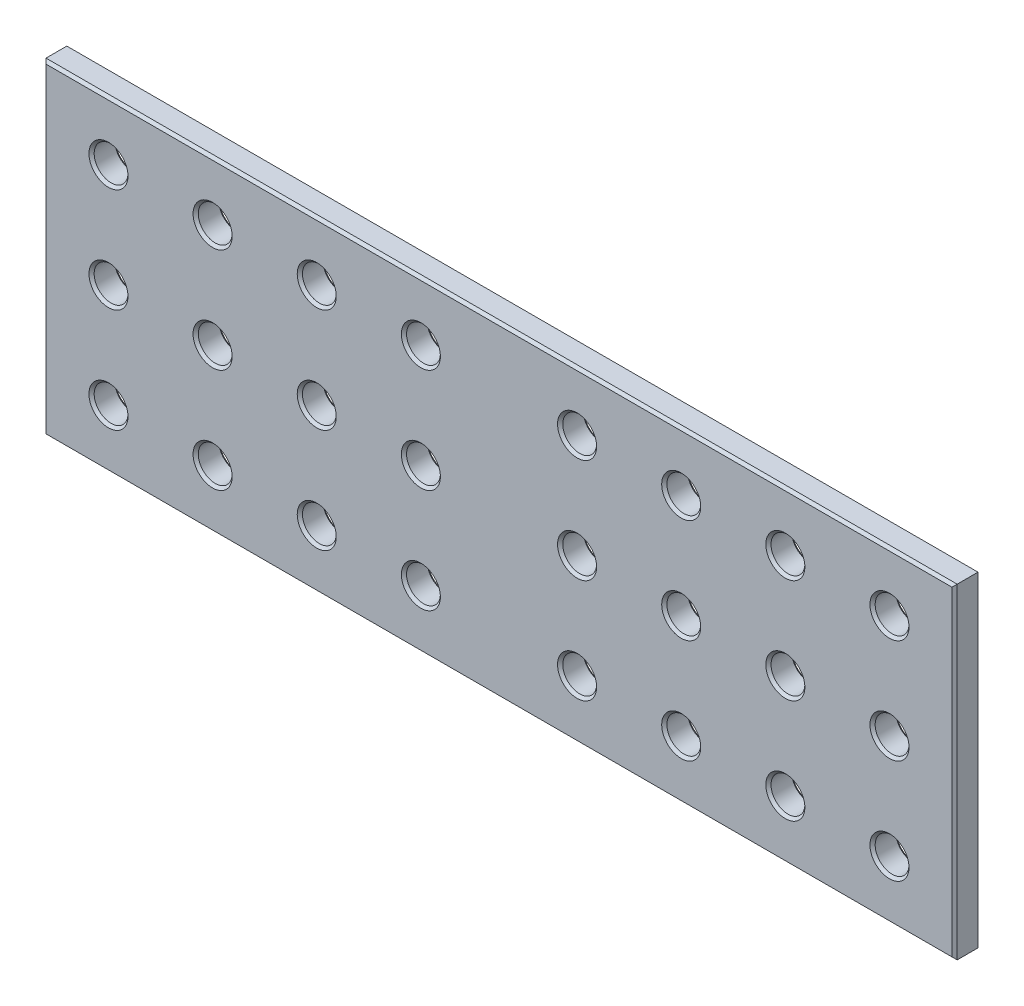
from build123d import *

# Parameters (mm, degrees)
SKETCH_1_W        = 700
SKETCH_1_H        = 250
SKETCH_1_R        = 13
EXTRUDE_664_DEPTH = 20
CHAMFER_1_SIZE    = 2


with BuildPart() as part:
    # 草图1 → Extrude 664 (new body)
    with BuildSketch(Plane.XY):
        Rectangle(SKETCH_1_W, SKETCH_1_H)
        with Locations((-300, 80)):
            Circle(SKETCH_1_R, mode=Mode.SUBTRACT)
        with Locations((-220, 80)):
            Circle(SKETCH_1_R, mode=Mode.SUBTRACT)
        with Locations((-140, 80)):
            Circle(SKETCH_1_R, mode=Mode.SUBTRACT)
        with Locations((-60, 80)):
            Circle(SKETCH_1_R, mode=Mode.SUBTRACT)
        with Locations((-60, 0)):
            Circle(SKETCH_1_R, mode=Mode.SUBTRACT)
        with Locations((-220, 0)):
            Circle(SKETCH_1_R, mode=Mode.SUBTRACT)
        with Locations((-300, 0)):
            Circle(SKETCH_1_R, mode=Mode.SUBTRACT)
        with Locations((-140, 0)):
            Circle(SKETCH_1_R, mode=Mode.SUBTRACT)
        with Locations(Location((-60, -80, 0), (0, 0, 180))):
            Circle(SKETCH_1_R, mode=Mode.SUBTRACT)
        with Locations(Location((-140, -80, 0), (0, 0, 180))):
            Circle(SKETCH_1_R, mode=Mode.SUBTRACT)
        with Locations(Location((-220, -80, 0), (0, 0, 180))):
            Circle(SKETCH_1_R, mode=Mode.SUBTRACT)
        with Locations(Location((-300, -80, 0), (0, 0, 180))):
            Circle(SKETCH_1_R, mode=Mode.SUBTRACT)
        with Locations((300, -80)):
            Circle(SKETCH_1_R, mode=Mode.SUBTRACT)
        with Locations((220, -80)):
            Circle(SKETCH_1_R, mode=Mode.SUBTRACT)
        with Locations((140, -80)):
            Circle(SKETCH_1_R, mode=Mode.SUBTRACT)
        with Locations((60, -80)):
            Circle(SKETCH_1_R, mode=Mode.SUBTRACT)
        with Locations(Location((140, 0, 0), (0, 0, 180))):
            Circle(SKETCH_1_R, mode=Mode.SUBTRACT)
        with Locations(Location((300, 0, 0), (0, 0, 180))):
            Circle(SKETCH_1_R, mode=Mode.SUBTRACT)
        with Locations(Location((220, 0, 0), (0, 0, 180))):
            Circle(SKETCH_1_R, mode=Mode.SUBTRACT)
        with Locations(Location((60, 0, 0), (0, 0, 180))):
            Circle(SKETCH_1_R, mode=Mode.SUBTRACT)
        with Locations(Location((60, 80, 0), (0, 0, 180))):
            Circle(SKETCH_1_R, mode=Mode.SUBTRACT)
        with Locations(Location((140, 80, 0), (0, 0, 180))):
            Circle(SKETCH_1_R, mode=Mode.SUBTRACT)
        with Locations(Location((220, 80, 0), (0, 0, 180))):
            Circle(SKETCH_1_R, mode=Mode.SUBTRACT)
        with Locations(Location((300, 80, 0), (0, 0, 180))):
            Circle(SKETCH_1_R, mode=Mode.SUBTRACT)
    extrude(amount=EXTRUDE_664_DEPTH)

    # 倒角1
    chamfer_1_edges = [part.edges().sort_by_distance(p)[0] for p in [
        (350, 0, 20),
        (-313, 80, 0),
        (-313, 80, 20),
        (0, 125, 20),
        (-233, 80, 0),
        (-233, 80, 20),
        (-153, 80, 0),
        (-153, 80, 20),
        (-73, 80, 0),
        (-73, 80, 20),
        (-73, 0, 0),
        (-73, 0, 20),
        (-233, 0, 0),
        (-233, 0, 20),
        (-313, 0, 0),
        (-313, 0, 20),
        (-153, 0, 0),
        (-153, 0, 20),
        (-350, 0, 20),
        (-47, -80, 0),
        (-47, -80, 20),
        (0, 125, 0),
        (-127, -80, 0),
        (-127, -80, 20),
        (350, 0, 0),
        (-207, -80, 0),
        (-207, -80, 20),
        (0, -125, 0),
        (-287, -80, 0),
        (-287, -80, 20),
        (-350, 0, 0),
        (287, -80, 0),
        (287, -80, 20),
        (207, -80, 0),
        (207, -80, 20),
        (127, -80, 0),
        (127, -80, 20),
        (47, -80, 0),
        (47, -80, 20),
        (0, -125, 20),
        (153, 0, 0),
        (153, 0, 20),
        (313, 0, 0),
        (313, 0, 20),
        (233, 0, 0),
        (233, 0, 20),
        (73, 0, 0),
        (73, 0, 20),
        (73, 80, 0),
        (73, 80, 20),
        (153, 80, 0),
        (153, 80, 20),
        (233, 80, 0),
        (233, 80, 20),
        (313, 80, 0),
        (313, 80, 20),
    ]]
    chamfer(chamfer_1_edges, length=CHAMFER_1_SIZE)


solid = part.part
